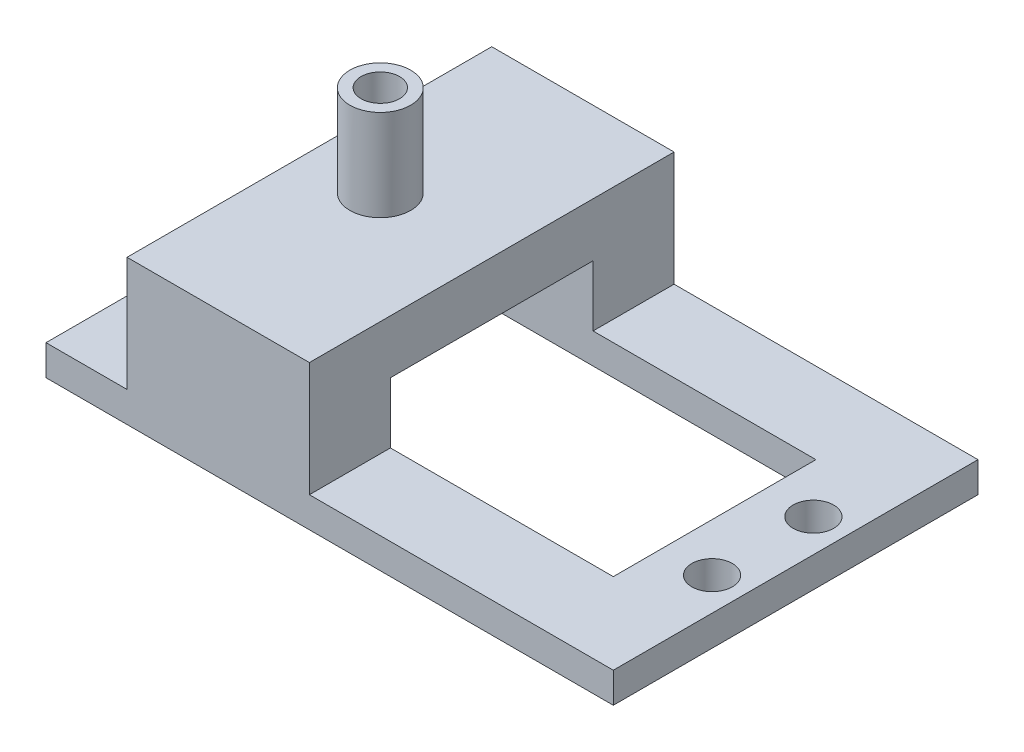
from build123d import *

# Parameters (mm, degrees)
SKETCH1_W           = 8
SKETCH1_H           = 20
SKETCH1_W_2         = 56
SKETCH1_H_2         = 8
BOSS_EXTRUDE1_DEPTH = 3
SKETCH2_W           = 18
SKETCH2_H           = 8
BOSS_EXTRUDE2_DEPTH = 6
SKETCH3_W           = 18
SKETCH3_H           = 36
BOSS_EXTRUDE3_DEPTH = 5.3
SKETCH5_R           = 1.9
CUT_EXTRUDE1_DEPTH  = 5.3
SKETCH6_R           = 3
SKETCH6_R_2         = 1.9
BOSS_EXTRUDE5_DEPTH = 9
CUT_EXTRUDE2_DEPTH  = 3
SKETCH8_R           = 2
CUT_EXTRUDE3_DEPTH  = 3


with BuildPart() as part:
    # Sketch1 → Boss-Extrude1 (new body)
    with BuildSketch(Plane(origin=(0, 0, 0), x_dir=(1, 0, 0), z_dir=(0, 1, 0))):
        Polygon((-29.097818748, 12.561692374), (-29.097818748, 4.561692374), (-21.097818748, 4.561692374), (18.902181252, 4.561692374), (26.902181252, 4.561692374), (26.902181252, 12.561692374), align=None)
        with Locations((-25.097818748, -5.438307626)):
            Rectangle(SKETCH1_W, SKETCH1_H)
        with Locations((22.902181252, -5.438307626)):
            Rectangle(SKETCH1_W, SKETCH1_H)
        with Locations((-1.097818748, -19.438307626)):
            Rectangle(SKETCH1_W_2, SKETCH1_H_2)
    extrude(amount=-BOSS_EXTRUDE1_DEPTH)

    # Sketch2 → Boss-Extrude2 (add)
    with BuildSketch(Plane(origin=(0, 0, 0), x_dir=(1, 0, 0), z_dir=(0, 1, 0))):
        with Locations((-12.097818748, 8.561692374)):
            Rectangle(SKETCH2_W, SKETCH2_H)
        with Locations((-12.097818748, -19.438307626)):
            Rectangle(SKETCH2_W, SKETCH2_H)
    extrude(amount=BOSS_EXTRUDE2_DEPTH)

    # Sketch3 → Boss-Extrude3 (add)
    with BuildSketch(Plane(origin=(0, 6, 0), x_dir=(1, 0, 0), z_dir=(0, 1, 0))):
        with Locations((-12.097818748, -5.438307626)):
            Rectangle(SKETCH3_W, SKETCH3_H)
    extrude(amount=BOSS_EXTRUDE3_DEPTH)

    # Sketch5 → Cut-Extrude1 (cut)
    with BuildSketch(Plane(origin=(0, 6, 0), x_dir=(1, 0, 0), z_dir=(0, 1, 0))):
        with Locations(Location((-14.097818748, -5.438307626, 0), (0, 0, 270))):
            Circle(SKETCH5_R)
    extrude(amount=CUT_EXTRUDE1_DEPTH, mode=Mode.SUBTRACT)

    # Sketch6 → Boss-Extrude5 (add)
    with BuildSketch(Plane(origin=(0, 11.3, 0), x_dir=(1, 0, 0), z_dir=(0, 1, 0))):
        with Locations(Location((-14.097818748, -5.438307626, 0), (0, 0, 90))):
            Circle(SKETCH6_R)
        with Locations(Location((-14.097818748, -5.438307626, 0), (0, 0, 270))):
            Circle(SKETCH6_R_2, mode=Mode.SUBTRACT)
    extrude(amount=BOSS_EXTRUDE5_DEPTH)

    # Sketch7 → Cut-Extrude2 (cut)
    with BuildSketch(Plane.XZ.offset(-6)):
        Polygon((-12.250616402, 1.957625885), (-10.159858765, 5.297690913), (-12.00706111, 8.778372654), (-15.945021093, 8.918989367), (-18.03577873, 5.578924339), (-16.188576385, 2.098242598), align=None)
    extrude(amount=-CUT_EXTRUDE2_DEPTH, mode=Mode.SUBTRACT)

    # Sketch8 → Cut-Extrude3 (cut)
    with BuildSketch(Plane(origin=(0, 0, 0), x_dir=(1, 0, 0), z_dir=(0, 1, 0))):
        with Locations(Location((23.652181252, -0.438307626, 0), (0, 0, 270))):
            Circle(SKETCH8_R)
        with Locations(Location((23.652181252, -10.438307626, 0), (0, 0, 270))):
            Circle(SKETCH8_R)
        with Locations(Location((-25.847818748, -0.438307626, 0), (0, 0, 270))):
            Circle(SKETCH8_R)
        with Locations(Location((-25.847818748, -10.438307626, 0), (0, 0, 270))):
            Circle(SKETCH8_R)
    extrude(amount=-CUT_EXTRUDE3_DEPTH, mode=Mode.SUBTRACT)


solid = part.part
